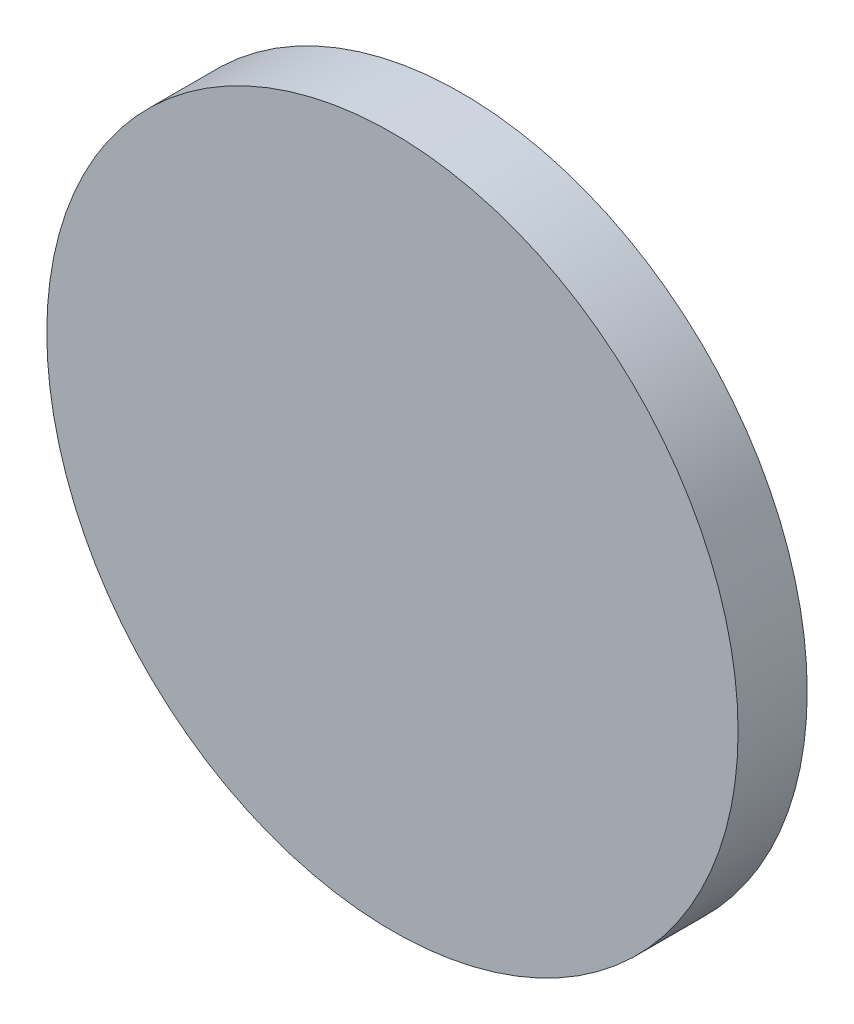
from build123d import *

# Parameters (mm, degrees)
SKETCH1_R           = 2.5
BOSS_EXTRUDE1_DEPTH = 0.5


with BuildPart() as part:
    # Sketch1 → Boss-Extrude1 (new body)
    with BuildSketch(Plane.XY):
        with Locations((-181.5, -45.5)):
            Circle(SKETCH1_R)
    extrude(amount=BOSS_EXTRUDE1_DEPTH)


solid = part.part
